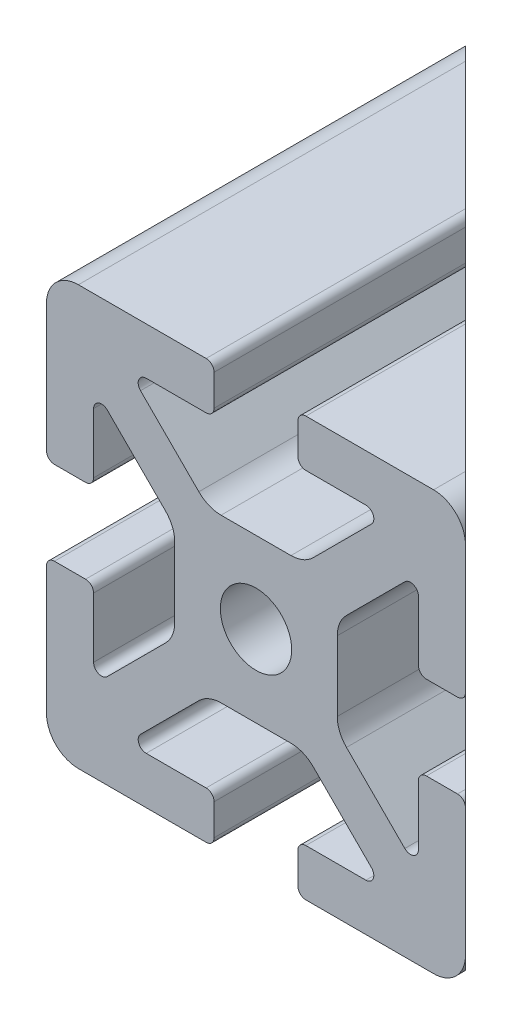
from build123d import *

# Parameters (mm, degrees)
SKETCH1_R          = 3.4036
EXTRUDE1_DEPTH     = 20
CUT_EXTRUDE1_DEPTH = 49.989794856


with BuildPart() as part:
    # Sketch1 → Extrude1 (new, symmetric)
    with BuildSketch(Plane.XY):
        with BuildLine():
            Line((-20, 16.952), (-20, 4.7625))
            ThreePointArc((-20, 4.7625), (-19.776815367, 4.223684633), (-19.238, 4.0005))
            Line((-19.238, 4.0005), (-16.2662, 4.0005))
            ThreePointArc((-16.2662, 4.0005), (-15.727384633, 4.223684633), (-15.5042, 4.7625))
            Line((-15.5042, 4.7625), (-15.5042, 10.485558599))
            ThreePointArc((-15.5042, 10.485558599), (-15.033804775, 11.189554802), (-14.203384633, 11.024373966))
            Line((-14.203384633, 11.024373966), (-8.635059555, 5.456048889))
            ThreePointArc((-8.635059555, 5.456048889), (-7.985348265, 4.483687227), (-7.7572, 3.336708444))
            Line((-7.7572, 3.336708444), (-7.7572, -3.336708444))
            ThreePointArc((-7.7572, -3.336708444), (-7.985348265, -4.483687227), (-8.635059555, -5.456048889))
            Line((-8.635059555, -5.456048889), (-14.203384633, -11.024373966))
            ThreePointArc((-14.203384633, -11.024373966), (-15.033804775, -11.189554802), (-15.5042, -10.485558599))
            Line((-15.5042, -10.485558599), (-15.5042, -4.7625))
            ThreePointArc((-15.5042, -4.7625), (-15.727384633, -4.223684633), (-16.2662, -4.0005))
            Line((-16.2662, -4.0005), (-19.238, -4.0005))
            ThreePointArc((-19.238, -4.0005), (-19.776815367, -4.223684633), (-20, -4.7625))
            Line((-20, -4.7625), (-20, -16.952))
            ThreePointArc((-20, -16.952), (-19.107261469, -19.107261469), (-16.952, -20))
            Line((-16.952, -20), (-4.7625, -20))
            ThreePointArc((-4.7625, -20), (-4.223684633, -19.776815367), (-4.0005, -19.238))
            Line((-4.0005, -19.238), (-4.0005, -16.2662))
            ThreePointArc((-4.0005, -16.2662), (-4.223684633, -15.727384633), (-4.7625, -15.5042))
            Line((-4.7625, -15.5042), (-10.485558599, -15.5042))
            ThreePointArc((-10.485558599, -15.5042), (-11.189554802, -15.033804775), (-11.024373966, -14.203384633))
            Line((-11.024373966, -14.203384633), (-5.456048889, -8.635059555))
            ThreePointArc((-5.456048889, -8.635059555), (-4.483687227, -7.985348265), (-3.336708444, -7.7572))
            Line((-3.336708444, -7.7572), (3.336708444, -7.7572))
            ThreePointArc((3.336708444, -7.7572), (4.483687227, -7.985348265), (5.456048889, -8.635059555))
            Line((5.456048889, -8.635059555), (11.024373966, -14.203384633))
            ThreePointArc((11.024373966, -14.203384633), (11.189554802, -15.033804775), (10.485558599, -15.5042))
            Line((10.485558599, -15.5042), (4.7625, -15.5042))
            ThreePointArc((4.7625, -15.5042), (4.223684633, -15.727384633), (4.0005, -16.2662))
            Line((4.0005, -16.2662), (4.0005, -19.238))
            ThreePointArc((4.0005, -19.238), (4.223684633, -19.776815367), (4.7625, -20))
            Line((4.7625, -20), (16.952, -20))
            ThreePointArc((16.952, -20), (19.107261469, -19.107261469), (20, -16.952))
            Line((20, -16.952), (20, -4.7625))
            ThreePointArc((20, -4.7625), (19.776815367, -4.223684633), (19.238, -4.0005))
            Line((19.238, -4.0005), (16.2662, -4.0005))
            ThreePointArc((16.2662, -4.0005), (15.727384633, -4.223684633), (15.5042, -4.7625))
            Line((15.5042, -4.7625), (15.5042, -10.485558599))
            ThreePointArc((15.5042, -10.485558599), (15.033804775, -11.189554802), (14.203384633, -11.024373966))
            Line((14.203384633, -11.024373966), (8.635059555, -5.456048889))
            ThreePointArc((8.635059555, -5.456048889), (7.985348265, -4.483687227), (7.7572, -3.336708444))
            Line((7.7572, -3.336708444), (7.7572, 3.336708444))
            ThreePointArc((7.7572, 3.336708444), (7.985348265, 4.483687227), (8.635059555, 5.456048889))
            Line((8.635059555, 5.456048889), (14.203384633, 11.024373966))
            ThreePointArc((14.203384633, 11.024373966), (15.033804775, 11.189554802), (15.5042, 10.485558599))
            Line((15.5042, 10.485558599), (15.5042, 4.7625))
            ThreePointArc((15.5042, 4.7625), (15.727384633, 4.223684633), (16.2662, 4.0005))
            Line((16.2662, 4.0005), (19.238, 4.0005))
            ThreePointArc((19.238, 4.0005), (19.776815367, 4.223684633), (20, 4.7625))
            Line((20, 4.7625), (20, 16.952))
            ThreePointArc((20, 16.952), (19.107261469, 19.107261469), (16.952, 20))
            Line((16.952, 20), (4.7625, 20))
            ThreePointArc((4.7625, 20), (4.223684633, 19.776815367), (4.0005, 19.238))
            Line((4.0005, 19.238), (4.0005, 16.2662))
            ThreePointArc((4.0005, 16.2662), (4.223684633, 15.727384633), (4.7625, 15.5042))
            Line((4.7625, 15.5042), (10.485558599, 15.5042))
            ThreePointArc((10.485558599, 15.5042), (11.189554802, 15.033804775), (11.024373966, 14.203384633))
            Line((11.024373966, 14.203384633), (5.456048889, 8.635059555))
            ThreePointArc((5.456048889, 8.635059555), (4.483687227, 7.985348265), (3.336708444, 7.7572))
            Line((3.336708444, 7.7572), (-3.336708444, 7.7572))
            ThreePointArc((-3.336708444, 7.7572), (-4.483687227, 7.985348265), (-5.456048889, 8.635059555))
            Line((-5.456048889, 8.635059555), (-11.024373966, 14.203384633))
            ThreePointArc((-11.024373966, 14.203384633), (-11.189554802, 15.033804775), (-10.485558599, 15.5042))
            Line((-10.485558599, 15.5042), (-4.7625, 15.5042))
            ThreePointArc((-4.7625, 15.5042), (-4.223684633, 15.727384633), (-4.0005, 16.2662))
            Line((-4.0005, 16.2662), (-4.0005, 19.238))
            ThreePointArc((-4.0005, 19.238), (-4.223684633, 19.776815367), (-4.7625, 20))
            Line((-4.7625, 20), (-16.952, 20))
            ThreePointArc((-16.952, 20), (-19.107261469, 19.107261469), (-20, 16.952))
        make_face()
        Circle(SKETCH1_R, mode=Mode.SUBTRACT)
    extrude(amount=EXTRUDE1_DEPTH, both=True)

    # Sketch3 → Cut-Extrude1 (cut, through all)
    with BuildSketch(Plane.XZ.offset(20)):
        Polygon((20, 20), (-20, -20), (20, -20), align=None)
    extrude(amount=-CUT_EXTRUDE1_DEPTH, mode=Mode.SUBTRACT)


solid = part.part
